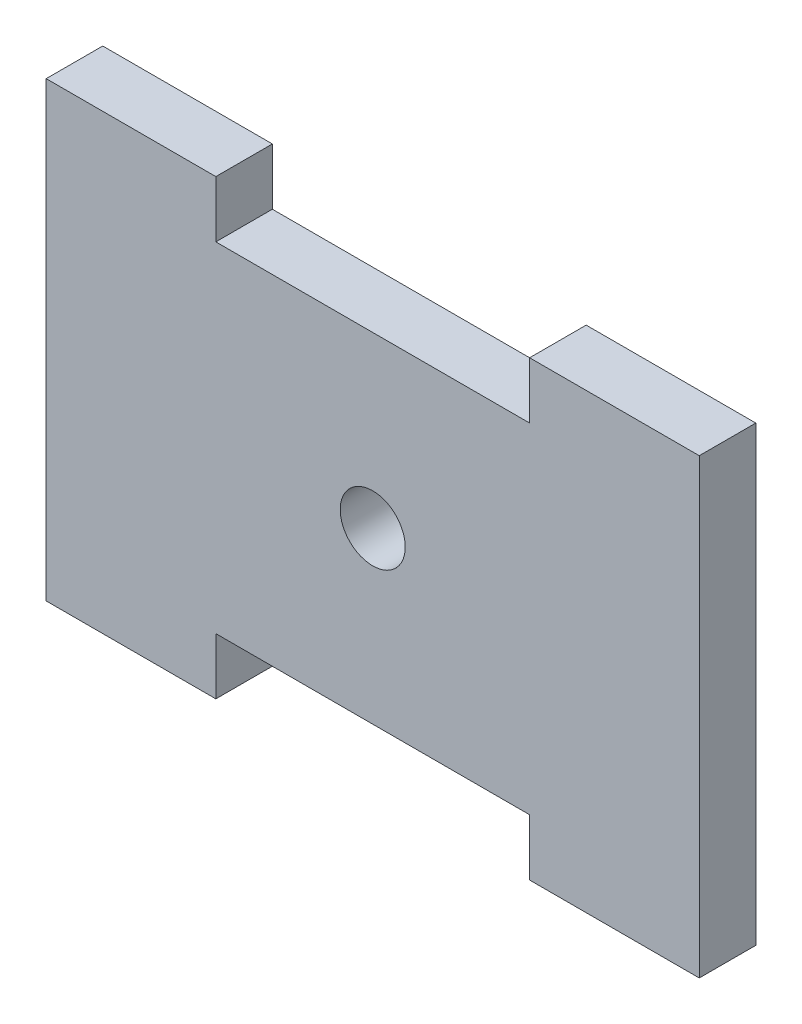
from build123d import *

# Parameters (mm, degrees)
SKETCH_1_R      = 1.15
EXTRUDE_1_DEPTH = 2


with BuildPart() as part:
    # 草图1 → 凸台-拉伸1 (new body)
    with BuildSketch(Plane.XY):
        Polygon((-3, 1), (3, 1), (3, -1), (14.1, -1), (14.1, 1), (20.1, 1), (20.1, -1), (20.1, -13), (20.1, -15), (14.1, -15), (14.1, -13), (3, -13), (3, -15), (-3, -15), (-3, -13), (-3, -1), align=None)
        with Locations((8.55, -7)):
            Circle(SKETCH_1_R, mode=Mode.SUBTRACT)
    extrude(amount=EXTRUDE_1_DEPTH)


solid = part.part
